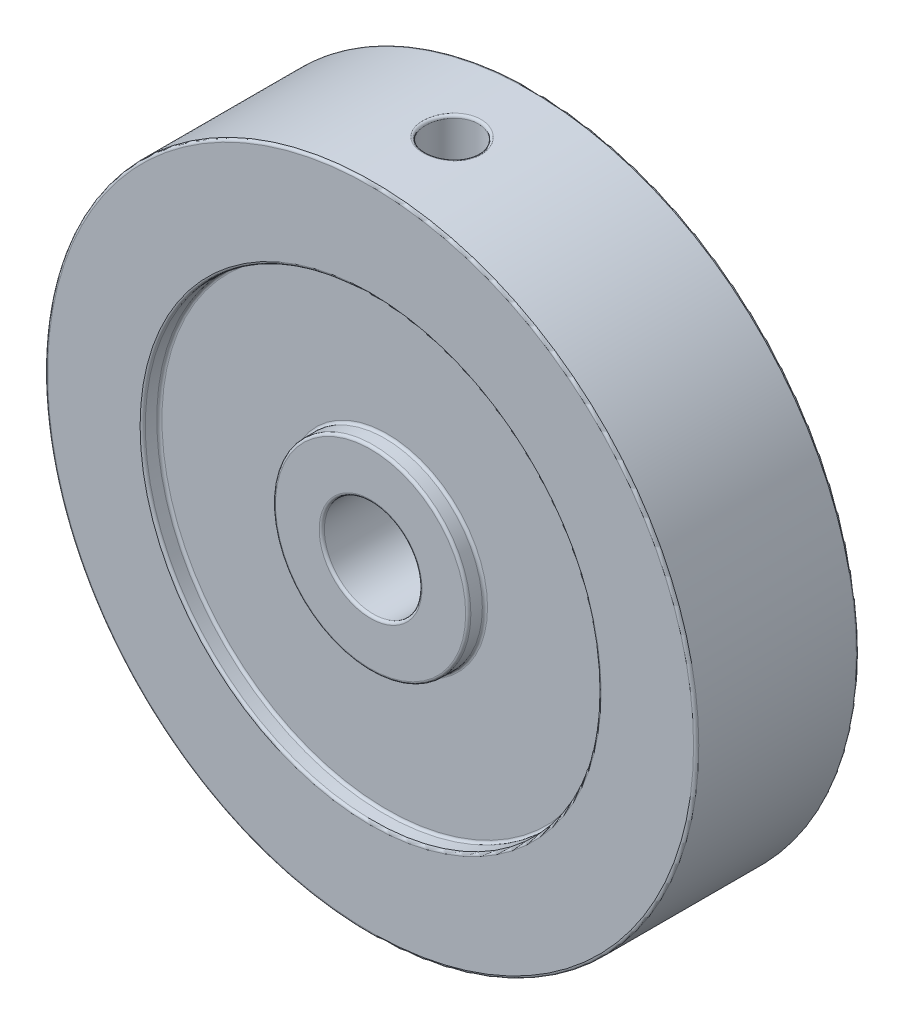
from build123d import *

# Parameters (mm, degrees)
SKETCH1_R                 = 15.875
BOSS_EXTRUDE1_DEPTH       = 3.96875
SKETCH2_R                 = 2.38125
CUT_EXTRUDE1_DEPTH        = 24.8125
SKETCH2_3_R               = 11.1125
SKETCH2_3_R_2             = 4.7625
CUT_EXTRUDE2_DEPTH        = 0.8128
F_5_40_TAPPED_HOLE1_D     = 2.5781
F_5_40_TAPPED_HOLE1_DEPTH = 16.51
F_5_40_TAPPED_HOLE1_TIP   = 0.774539381
FILLET1_R                 = 0.127


with BuildPart() as part:
    # Sketch1 → Boss-Extrude1 (new, symmetric)
    with BuildSketch(Plane.XY):
        Circle(SKETCH1_R)
    extrude(amount=BOSS_EXTRUDE1_DEPTH, both=True)

    # Sketch2 → Cut-Extrude1 (cut, through all)
    with BuildSketch(Plane.XY.offset(3.96875)):
        Circle(SKETCH2_R)
    extrude(amount=-CUT_EXTRUDE1_DEPTH, mode=Mode.SUBTRACT)

    # Sketch2<3> → Cut-Extrude2 (cut)
    with BuildSketch(Plane.XY.offset(3.96875)):
        Circle(SKETCH2_3_R)
        Circle(SKETCH2_3_R_2, mode=Mode.SUBTRACT)
    cut_extrude2 = extrude(amount=-CUT_EXTRUDE2_DEPTH, mode=Mode.SUBTRACT)

    # Mirror2: Cut-Extrude2 across plane
    add(cut_extrude2.mirror(Plane.XY), mode=Mode.SUBTRACT)

    # #5-40 Tapped Hole1
    with Locations(Plane(origin=(0, 15.875, 0), x_dir=(1, 0, 0), z_dir=(0, 1, 0))):
        with Locations((0, 0)):
            Hole(F_5_40_TAPPED_HOLE1_D / 2, depth=F_5_40_TAPPED_HOLE1_DEPTH)
            with Locations((0, 0, -(F_5_40_TAPPED_HOLE1_DEPTH + F_5_40_TAPPED_HOLE1_TIP / 2))):  # 118° drill point
                Cone(0, F_5_40_TAPPED_HOLE1_D / 2, F_5_40_TAPPED_HOLE1_TIP, mode=Mode.SUBTRACT)

    # Fillet1
    fillet1_edges = [part.edges().sort_by_distance(p)[0] for p in [
        (-4.7625, 0, -3.96875),
        (-2.38125, 0, -3.96875),
        (-11.1125, 0, -3.15595),
        (-4.7625, 0, -3.15595),
        (-11.1125, 0, -3.96875),
        (-4.7625, 0, 3.96875),
        (-2.38125, 0, 3.96875),
        (-11.1125, 0, 3.15595),
        (-4.7625, 0, 3.15595),
        (-11.1125, 0, 3.96875),
        (-15.875, 0, -3.96875),
        (-15.875, 0, 3.96875),
        (1.289050005, 15.822578017, 2e-09),
    ]]
    fillet(fillet1_edges, radius=FILLET1_R)


solid = part.part
